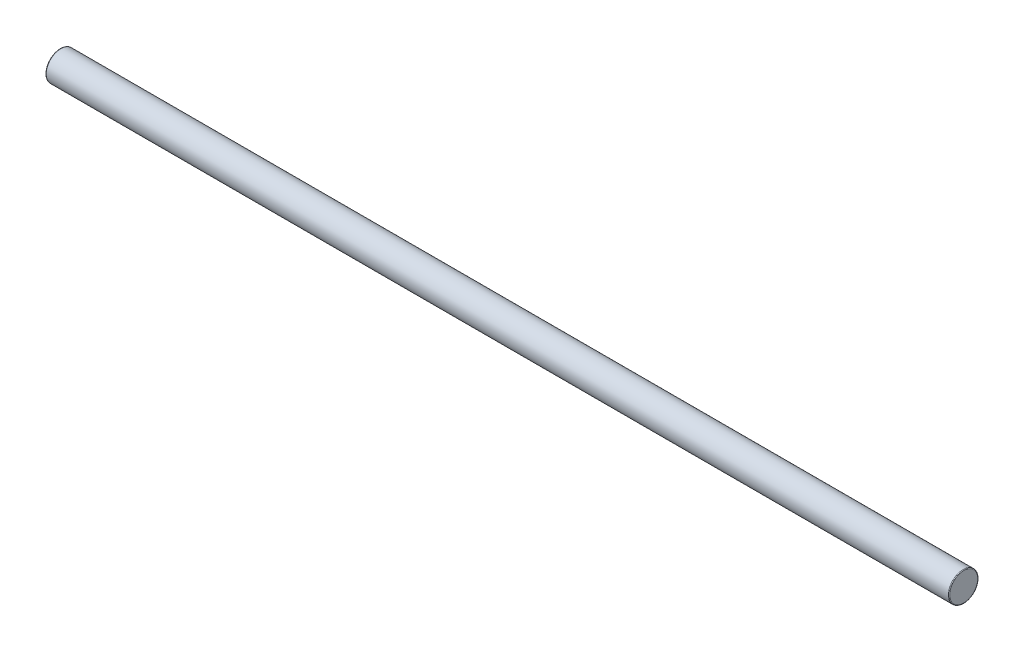
from build123d import *

# Parameters (mm, degrees)
SKETCH1_R           = 31.73095
BOSS_EXTRUDE1_DEPTH = 1952.752
FILLET1_R           = 1.524


with BuildPart() as part:
    # Sketch1 → Boss-Extrude1 (new body)
    with BuildSketch(Plane.YZ):
        with Locations(Location((976.376, 0, 0), (0, 0, 270))):
            Circle(SKETCH1_R)
    extrude(amount=BOSS_EXTRUDE1_DEPTH)

    # Fillet1
    fillet1_edges = [part.edges().sort_by_distance(p)[0] for p in [
        (0, 976.376, 31.73095),
        (1952.752, 976.376, 31.73095),
    ]]
    fillet(fillet1_edges, radius=FILLET1_R)


solid = part.part
